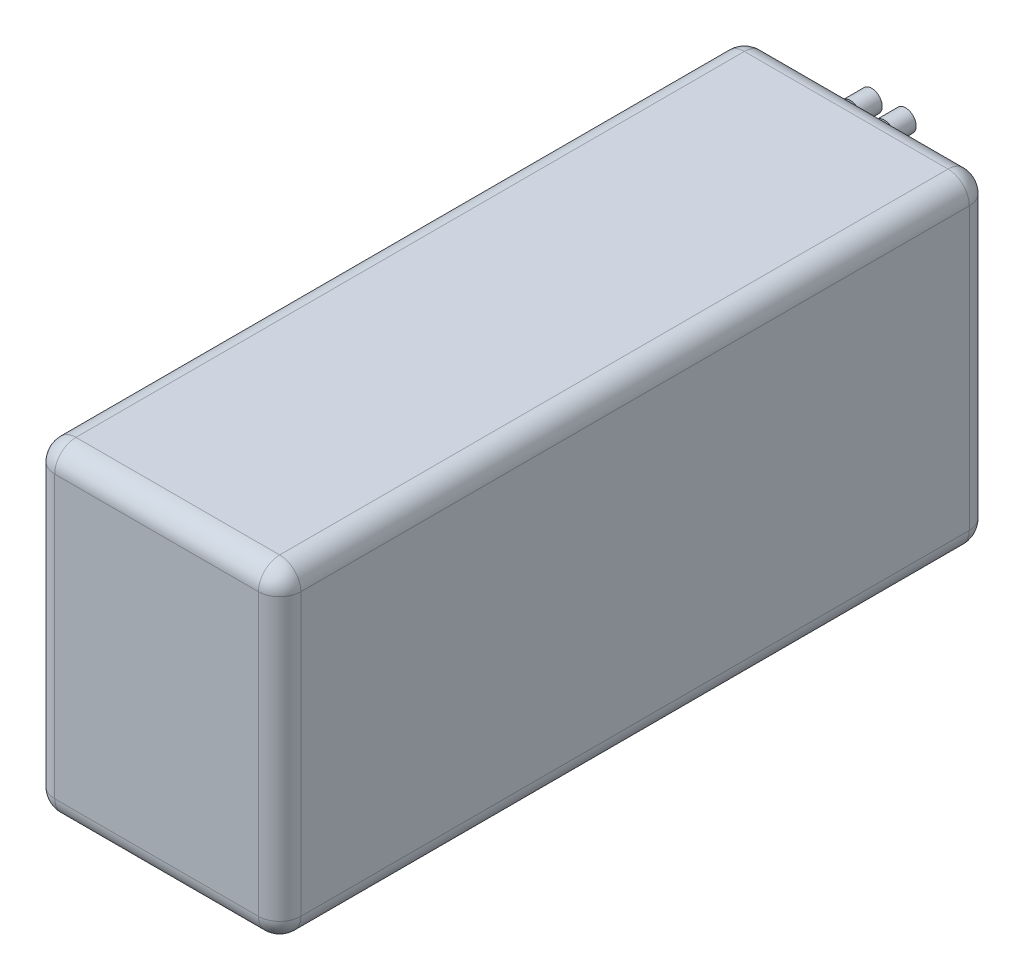
from build123d import *

# Parameters (mm, degrees)
SKETCH_1_W      = 23.2
SKETCH_1_H      = 67
EXTRUDE_1_DEPTH = 30.5
FILLET_2_R      = 2
SKETCH_2_R      = 1
SKETCH_2_R_2    = 0.5
EXTRUDE_2_DEPTH = 2


with BuildPart() as part:
    # Эскиз1 → Бобышка-Вытянуть1 (new body)
    with BuildSketch(Plane(origin=(0, 0, 0), x_dir=(1, 0, 0), z_dir=(0, 1, 0))):
        Rectangle(SKETCH_1_W, SKETCH_1_H)
    extrude(amount=EXTRUDE_1_DEPTH)

    # Скругление2
    fillet_2_edges = [part.edges().sort_by_distance(p)[0] for p in [
        (-11.6, 30.5, 0),
        (0, 30.5, 33.5),
        (11.6, 30.5, 0),
        (0, 0, 33.5),
        (-11.6, 0, 0),
        (0, 0, -33.5),
        (11.6, 0, 0),
        (0, 30.5, -33.5),
        (11.6, 15.25, 33.5),
        (-11.6, 15.25, 33.5),
        (-11.6, 15.25, -33.5),
        (11.6, 15.25, -33.5),
    ]]
    fillet(fillet_2_edges, radius=FILLET_2_R)

    # Эскиз2 → Бобышка-Вытянуть2 (add)
    with BuildSketch(Plane(origin=(0, 0, -33.5), x_dir=(-1, 0, 0), z_dir=(0, 0, -1))):
        with Locations((-1.6, 28.5)):
            Circle(SKETCH_2_R)
        with Locations((1.6, 28.5)):
            Circle(SKETCH_2_R)
        with Locations(Location((-0.6, 4.698268405, 0), (0, 0, 180))):
            Circle(SKETCH_2_R_2)
        with Locations(Location((-2.1, 4.698268405, 0), (0, 0, 180))):
            Circle(SKETCH_2_R_2)
        with Locations(Location((0.6, 4.698268405, 0), (0, 0, 180))):
            Circle(SKETCH_2_R_2)
        with Locations(Location((2.1, 4.698268405, 0), (0, 0, 180))):
            Circle(SKETCH_2_R_2)
    extrude(amount=EXTRUDE_2_DEPTH)


solid = part.part
